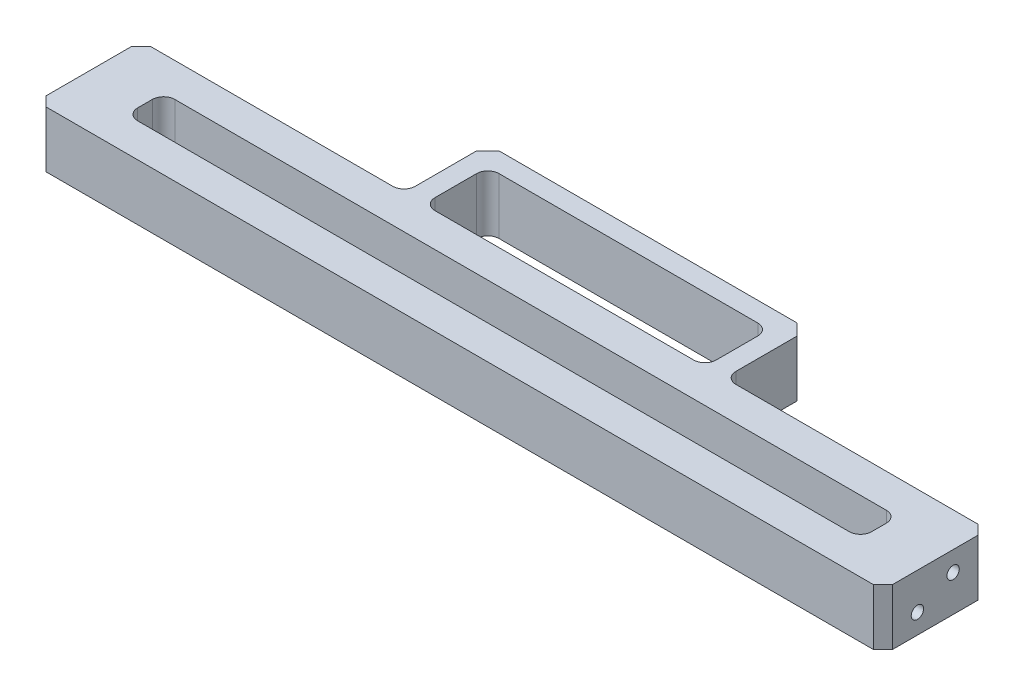
from build123d import *

# Parameters (mm, degrees)
SKETCH2_W              = 191.135
SKETCH2_H              = 23.622
MOUNT_BAR_DEPTH        = 6.35
MOUNT_FEATURE_DEPTH    = 12.7
FILLET1_R              = 2.54
SKETCH5_R              = 1.397
MOUNT_HOLES_DEPTH      = 10.795
SKETCH6_W              = 53.34
SKETCH6_H              = 6.985
BOSS_EXTRUDE5_DEPTH    = 12.7
FILLET2_R              = 2.54
CHAMFER1_SIZE          = 2.54
CHAMFER2_SIZE          = 2.159
SKETCH7_W              = 165.735
SKETCH7_H              = 8.382
WEIGHT_REDUCTION_DEPTH = 104.551367988
FILLET3_R              = 2.54


with BuildPart() as part:
    # Sketch2 → Mount-Bar (new, symmetric)
    with BuildSketch(Plane(origin=(0, 0, 0), x_dir=(1, 0, 0), z_dir=(0, 1, 0))):
        Rectangle(SKETCH2_W, SKETCH2_H)
    extrude(amount=MOUNT_BAR_DEPTH, both=True)

    # Sketch4 → Mount-Feature (add)
    with BuildSketch(Plane(origin=(0, 6.35, 0), x_dir=(1, 0, 0), z_dir=(0, 1, 0))):
        Polygon((-31.75, 11.811), (-31.75, 26.289), (31.75, 26.289), (31.75, 11.811), (36.195, 11.811), (36.195, 30.734), (-36.195, 30.734), (-36.195, 11.811), align=None)
    extrude(amount=-MOUNT_FEATURE_DEPTH)

    # Fillet1
    fillet1_edges = [part.edges().sort_by_distance(p)[0] for p in [
        (-31.75, 0, -11.811),
        (-36.195, 0, -11.811),
        (36.195, 0, -11.811),
        (31.75, 0, -11.811),
        (31.75, 0, -26.289),
        (-31.75, 0, -26.289),
    ]]
    fillet(fillet1_edges, radius=FILLET1_R)

    # Sketch5 → Mount-Holes (cut)
    with BuildSketch(Plane.ZY.offset(95.5675)):
        with Locations((-4.028538113, 1.878538173)):
            Circle(SKETCH5_R)
        with Locations((4.028538113, -1.878538173)):
            Circle(SKETCH5_R)
    mount_holes = extrude(amount=-MOUNT_HOLES_DEPTH, mode=Mode.SUBTRACT)

    # Mirror1: Mount-Holes across plane
    add(mount_holes.mirror(Plane(origin=(0, 0, 0), x_dir=(0, 0, 1), z_dir=(1, 0, 0))), mode=Mode.SUBTRACT)

    # Sketch6 → Boss-Extrude5 (add)
    with BuildSketch(Plane.XZ.offset(6.35)):
        with Locations((0, -8.3185)):
            Rectangle(SKETCH6_W, SKETCH6_H)
    extrude(amount=BOSS_EXTRUDE5_DEPTH)

    # Fillet2
    fillet2_edges = [part.edges().sort_by_distance(p)[0] for p in [
        (-26.67, -6.35, -8.3185),
        (0, -6.35, -4.826),
        (26.67, -6.35, -8.3185),
    ]]
    fillet(fillet2_edges, radius=FILLET2_R)

    # Chamfer1
    chamfer1_edges = [part.edges().sort_by_distance(p)[0] for p in [
        (0, -19.05, -4.826),
        (-36.195, 0, -30.734),
        (36.195, 0, -30.734),
    ]]
    chamfer(chamfer1_edges, length=CHAMFER1_SIZE)

    # Chamfer2
    chamfer2_edges = [part.edges().sort_by_distance(p)[0] for p in [
        (-95.5675, 0, -11.811),
        (95.5675, 0, -11.811),
        (95.5675, 0, 11.811),
        (-95.5675, 0, 11.811),
    ]]
    chamfer(chamfer2_edges, length=CHAMFER2_SIZE)

    # Sketch7 → weight-reduction (cut, through all)
    with BuildSketch(Plane(origin=(0, 6.35, 0), x_dir=(1, 0, 0), z_dir=(0, 1, 0))):
        Rectangle(SKETCH7_W, SKETCH7_H)
    extrude(amount=-WEIGHT_REDUCTION_DEPTH, mode=Mode.SUBTRACT)

    # Fillet3
    fillet3_edges = [part.edges().sort_by_distance(p)[0] for p in [
        (-82.8675, 0, 4.191),
        (82.8675, 0, -4.191),
        (82.8675, 0, 4.191),
        (-82.8675, 0, -4.191),
    ]]
    fillet(fillet3_edges, radius=FILLET3_R)


solid = part.part
